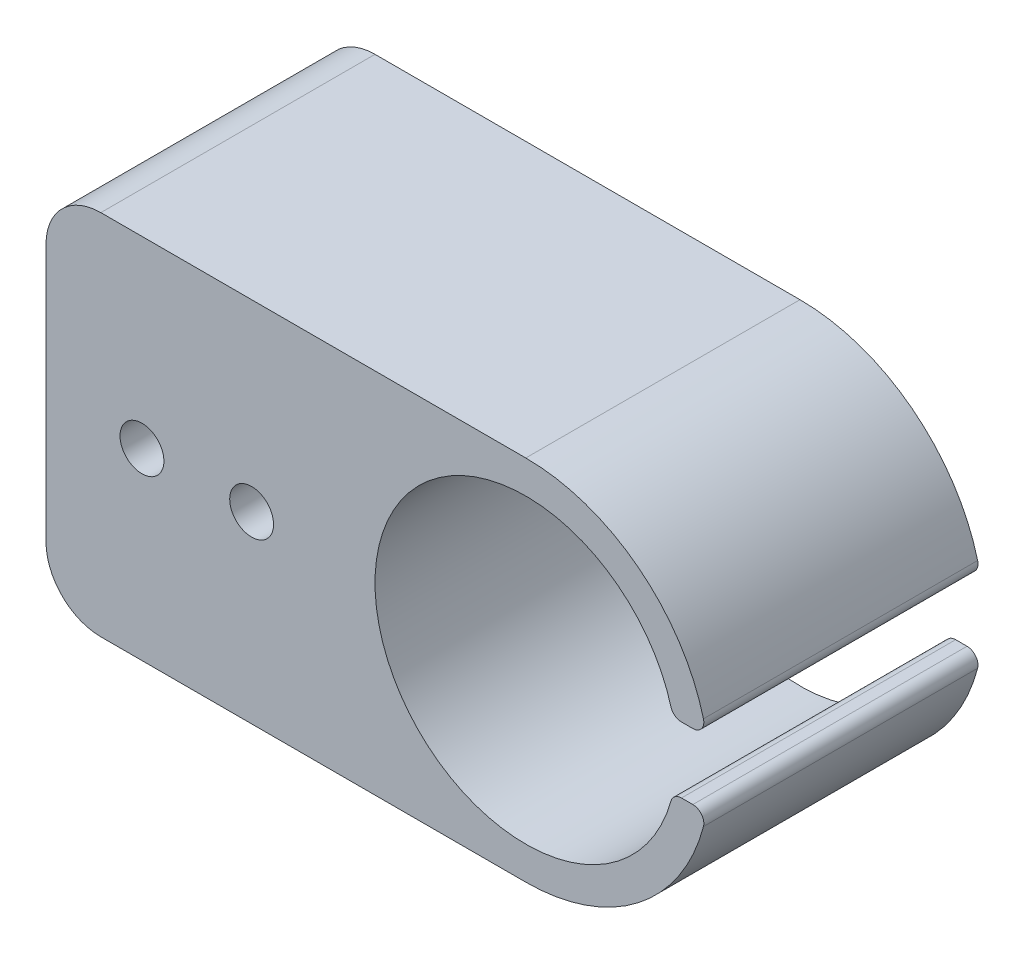
from build123d import *

# Parameters (mm, degrees)
ESQUISSE1_R             = 2
BOSS_EXTRU_1_DEPTH      = 25
CONG_1_R                = 5
CONG_2_R                = 1
ENL_V_MAT_EXTRU_1_DEPTH = 10


with BuildPart() as part:
    # Esquisse1 → Boss.-Extru.1 (new body)
    with BuildSketch(Plane.XY):
        with BuildLine():
            Line((13.4187369, 3), (16.479153498, 3))
            ThreePointArc((16.479153498, 3), (10.731088016, 12.861036117), (0, 16.75))
            Line((0, 16.75), (-43.75, 16.75))
            Line((-43.75, 16.75), (-43.75, -16.75))
            Line((-43.75, -16.75), (0, -16.75))
            ThreePointArc((0, -16.75), (10.731088016, -12.861036117), (16.479153498, -3))
            Line((16.479153498, -3), (13.4187369, -3))
            ThreePointArc((13.4187369, -3), (-13.75, 0), (13.4187369, 3))
        make_face()
        with Locations((-35, 0)):
            Circle(ESQUISSE1_R, mode=Mode.SUBTRACT)
        with Locations((-25, 0)):
            Circle(ESQUISSE1_R, mode=Mode.SUBTRACT)
    extrude(amount=BOSS_EXTRU_1_DEPTH)

    # Congé1
    cong_1_edges = [part.edges().sort_by_distance(p)[0] for p in [
        (-43.75, -16.75, 12.5),
        (-43.75, 16.75, 12.5),
    ]]
    fillet(cong_1_edges, radius=CONG_1_R)

    # Congé2
    cong_2_edges = [part.edges().sort_by_distance(p)[0] for p in [
        (13.4187369, -3, 12.5),
        (16.479153498, -3, 12.5),
        (16.479153498, 3, 12.5),
        (13.4187369, 3, 12.5),
    ]]
    fillet(cong_2_edges, radius=CONG_2_R)

    # Esquisse2 → Enlèv. mat.-Extru.1 (cut)
    with BuildSketch(Plane(origin=(0, 0, 0), x_dir=(-1, 0, 0), z_dir=(0, 0, -1))):
        with BuildLine():
            Line((43.75, 10.1), (25, 10.1))
            ThreePointArc((25, 10.1), (14.9, 0), (25, -10.1))
            Line((25, -10.1), (43.75, -10.1))
            Line((43.75, -10.1), (43.75, 10.1))
        make_face()
    extrude(amount=-ENL_V_MAT_EXTRU_1_DEPTH, mode=Mode.SUBTRACT)


solid = part.part
